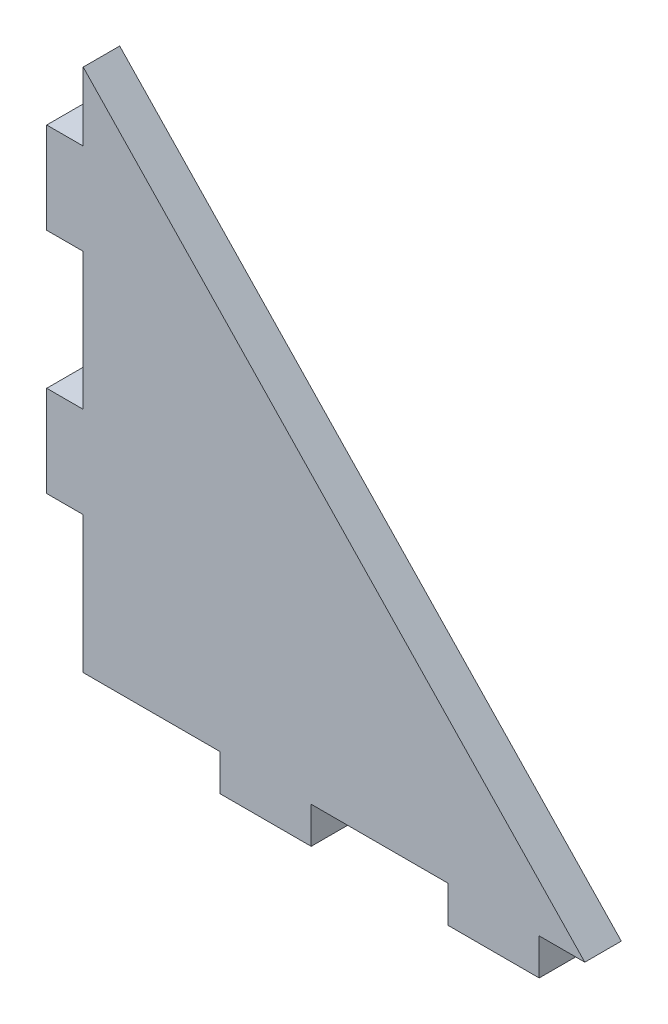
from build123d import *

# Parameters (mm, degrees)
BOSS_EXTRU_1_DEPTH = 8
ESQUISSE2_W        = 8
ESQUISSE2_H        = 20
BOSS_EXTRU_2_DEPTH = 8
ESQUISSE3_W        = 20
ESQUISSE3_H        = 8
BOSS_EXTRU_3_DEPTH = 8


with BuildPart() as part:
    # Esquisse1 → Boss.-Extru.1 (new body)
    with BuildSketch(Plane.XY):
        Polygon((0, 0), (110, 0), (0, 115), align=None)
    extrude(amount=BOSS_EXTRU_1_DEPTH)

    # Esquisse2 → Boss.-Extru.2 (add)
    with BuildSketch(Plane.XY):
        with Locations((-4, 40)):
            Rectangle(ESQUISSE2_W, ESQUISSE2_H)
        with Locations((-4, 90)):
            Rectangle(ESQUISSE2_W, ESQUISSE2_H)
    extrude(amount=BOSS_EXTRU_2_DEPTH)

    # Esquisse3 → Boss.-Extru.3 (add)
    with BuildSketch(Plane.XY):
        with Locations((40, -4)):
            Rectangle(ESQUISSE3_W, ESQUISSE3_H)
        with Locations((90, -4)):
            Rectangle(ESQUISSE3_W, ESQUISSE3_H)
    extrude(amount=BOSS_EXTRU_3_DEPTH)


solid = part.part
